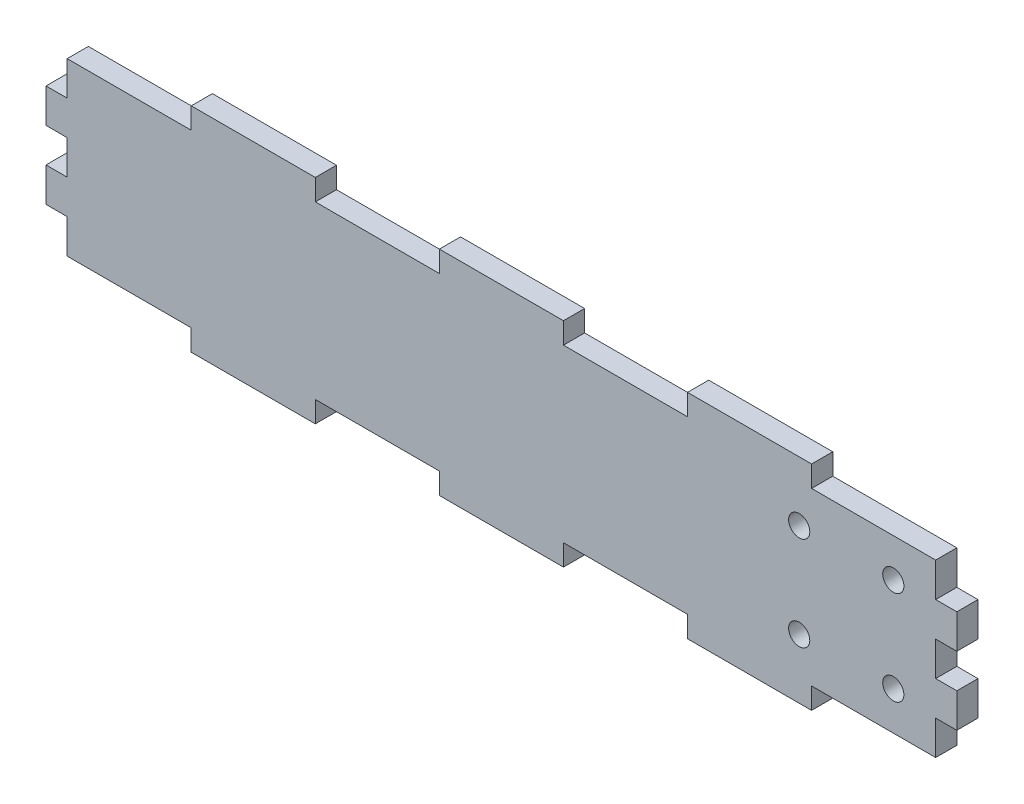
from build123d import *

# Parameters (mm, degrees)
BOSS_EXTRUDE1_DEPTH = 10
SKETCH3_R           = 5
CUT_EXTRUDE1_DEPTH  = 222.151916112


with BuildPart() as part:
    # Sketch2 → Boss-Extrude1 (new body)
    with BuildSketch(Plane.XY):
        Polygon((-205.1, 40.4), (-205.1, 24.24), (-215.1, 24.24), (-215.1, 8.08), (-205.1, 8.08), (-205.1, -8.08), (-215.1, -8.08), (-215.1, -24.24), (-205.1, -24.24), (-205.1, -40.4), (-146.5, -40.4), (-146.5, -50.4), (-87.9, -50.4), (-87.9, -40.4), (-29.3, -40.4), (-29.3, -50.4), (29.3, -50.4), (29.3, -40.4), (87.9, -40.4), (87.9, -50.4), (146.5, -50.4), (146.5, -40.4), (205.1, -40.4), (205.1, -24.24), (215.1, -24.24), (215.1, -8.08), (205.1, -8.08), (205.1, 8.08), (215.1, 8.08), (215.1, 24.24), (205.1, 24.24), (205.1, 40.4), (146.5, 40.4), (146.5, 50.4), (87.9, 50.4), (87.9, 40.4), (29.3, 40.4), (29.3, 50.4), (-29.3, 50.4), (-29.3, 40.4), (-87.9, 40.4), (-87.9, 50.4), (-146.5, 50.4), (-146.5, 40.4), align=None)
    extrude(amount=BOSS_EXTRUDE1_DEPTH)

    # Sketch3 → Cut-Extrude1 (cut, through all)
    with BuildSketch(Plane.XY.offset(10)):
        with Locations((185.1, 22.225)):
            Circle(SKETCH3_R)
        with Locations((140.65, 22.225)):
            Circle(SKETCH3_R)
        with Locations((140.65, -22.225)):
            Circle(SKETCH3_R)
        with Locations((185.1, -22.225)):
            Circle(SKETCH3_R)
    extrude(amount=-CUT_EXTRUDE1_DEPTH, mode=Mode.SUBTRACT)


solid = part.part
